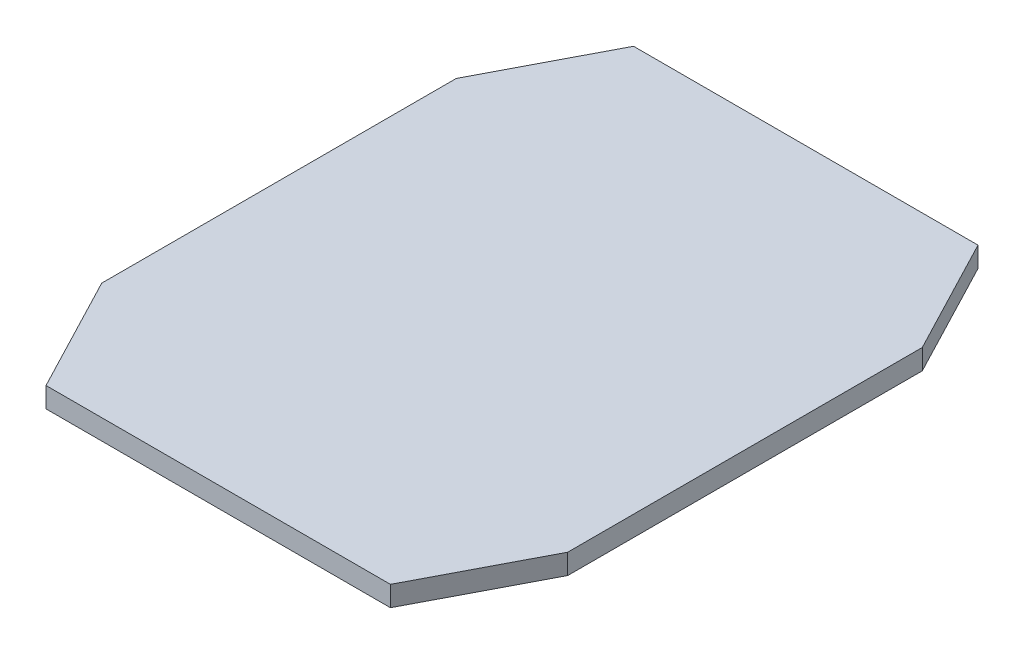
from build123d import *

# Parameters (mm, degrees)
SKETCH1_W           = 310
SKETCH1_H           = 290
BOSS_EXTRUDE1_DEPTH = 10
CUT_EXTRUDE1_DEPTH  = 213.485293609


with BuildPart() as part:
    # Sketch1 → Boss-Extrude1 (new body)
    with BuildSketch(Plane(origin=(0, 0, 0), x_dir=(1, 0, 0), z_dir=(0, 1, 0))):
        Rectangle(SKETCH1_W, SKETCH1_H)
    extrude(amount=BOSS_EXTRUDE1_DEPTH)

    # Sketch2 → Cut-Extrude1 (cut, through all)
    with BuildSketch(Plane(origin=(0, 10, 0), x_dir=(1, 0, 0), z_dir=(0, 1, 0))):
        Polygon((-85.000000005, 145), (-115.000000006, 87.499999999), (-115.000000006, -87.500000001), (-85, -145), (-155, -145), (-155.000000005, 145), align=None)
        Polygon((155, -145), (155.000000005, 145), (85.000000005, 145), (115.000000006, 87.499999999), (115.000000006, -87.500000001), (85, -145), align=None)
    extrude(amount=-CUT_EXTRUDE1_DEPTH, mode=Mode.SUBTRACT)


solid = part.part
